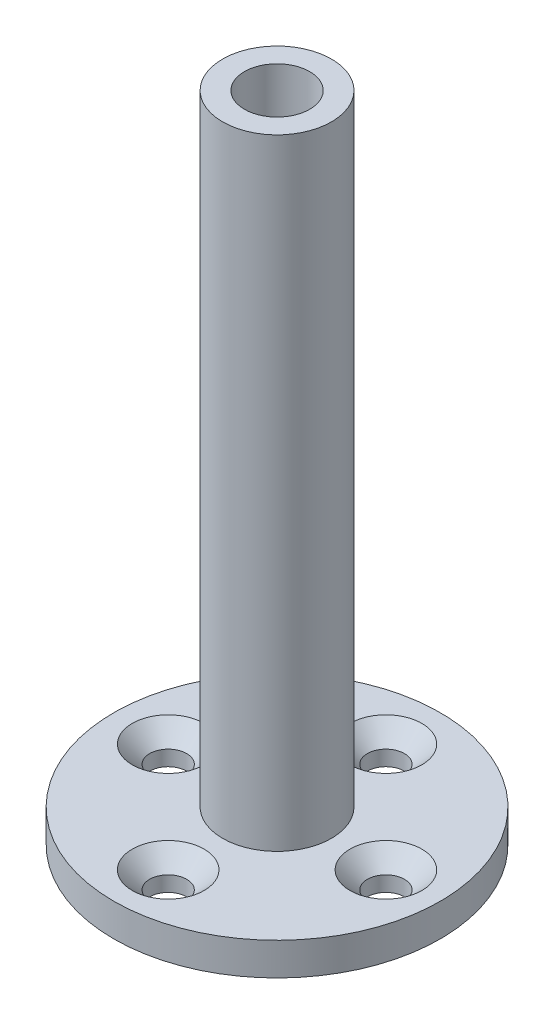
from build123d import *

# Parameters (mm, degrees)
SKETCH_1_R               = 5
SKETCH_1_R_2             = 3
EXTRUDE_2_DEPTH          = 60
SKETCH_2_R               = 15
SKETCH_2_R_2             = 5
EXTRUDE_3_DEPTH          = 3
HOLE_WIZARD_1_AT_2_COUNT = 2
HOLE_WIZARD_1_AT_2_PITCH = 14.142135624
HOLE_WIZARD_1_AT_3_COUNT = 2
HOLE_WIZARD_1_AT_3_PITCH = 20
HOLE_WIZARD_1_AT_4_COUNT = 2
HOLE_WIZARD_1_AT_4_PITCH = 14.142135624


with BuildPart() as part:
    # 草图1 → 凸台-拉伸2 (new body)
    with BuildSketch(Plane(origin=(0, 0, 0), x_dir=(1, 0, 0), z_dir=(0, 1, 0))):
        with Locations(Location((0, 0, 0), (0, 0, 270))):
            Circle(SKETCH_1_R)
        with Locations(Location((0, 0, 0), (0, 0, 270))):
            Circle(SKETCH_1_R_2, mode=Mode.SUBTRACT)
    extrude(amount=EXTRUDE_2_DEPTH)

    # 草图2 → 凸台-拉伸3 (add)
    with BuildSketch(Plane(origin=(0, 0, 0), x_dir=(1, 0, 0), z_dir=(0, 1, 0))):
        with Locations(Location((0, 0, 0), (0, 0, 270))):
            Circle(SKETCH_2_R)
        with Locations(Location((0, 0, 0), (0, 0, 270))):
            Circle(SKETCH_2_R_2, mode=Mode.SUBTRACT)
    extrude(amount=EXTRUDE_3_DEPTH)

    # 草图4 → 打孔尺寸(%根据)开槽沉头木螺钉的类型1 (revolve, cut)
    with BuildSketch(Plane(origin=(-10, 3, 0), x_dir=(0, 0, 1), z_dir=(1, 0, 0))):
        Polygon((0, 0), (0, 3), (1.7, 3), (1.7, 1.6), (3.3, 0), align=None)
    hole_wizard_1 = revolve(axis=Axis((-10, 9.35, 0), (0, -1, 0)), mode=Mode.SUBTRACT)

    # 打孔尺寸(%根据)开槽沉头木螺钉的类型1 at 2: 打孔尺寸(%根据)开槽沉头木螺钉的类型1 ×2
    with Locations(*[Vector(0.7071067811865476, 0, 0.7071067811865476) * (i * HOLE_WIZARD_1_AT_2_PITCH) for i in range(1, HOLE_WIZARD_1_AT_2_COUNT)]):
        add(hole_wizard_1, mode=Mode.SUBTRACT)

    # 打孔尺寸(%根据)开槽沉头木螺钉的类型1 at 3: 打孔尺寸(%根据)开槽沉头木螺钉的类型1 ×2
    with Locations(*[(i * HOLE_WIZARD_1_AT_3_PITCH, 0, 0) for i in range(1, HOLE_WIZARD_1_AT_3_COUNT)]):
        add(hole_wizard_1, mode=Mode.SUBTRACT)

    # 打孔尺寸(%根据)开槽沉头木螺钉的类型1 at 4: 打孔尺寸(%根据)开槽沉头木螺钉的类型1 ×2
    with Locations(*[Vector(0.7071067811865476, 0, -0.7071067811865476) * (i * HOLE_WIZARD_1_AT_4_PITCH) for i in range(1, HOLE_WIZARD_1_AT_4_COUNT)]):
        add(hole_wizard_1, mode=Mode.SUBTRACT)


solid = part.part
